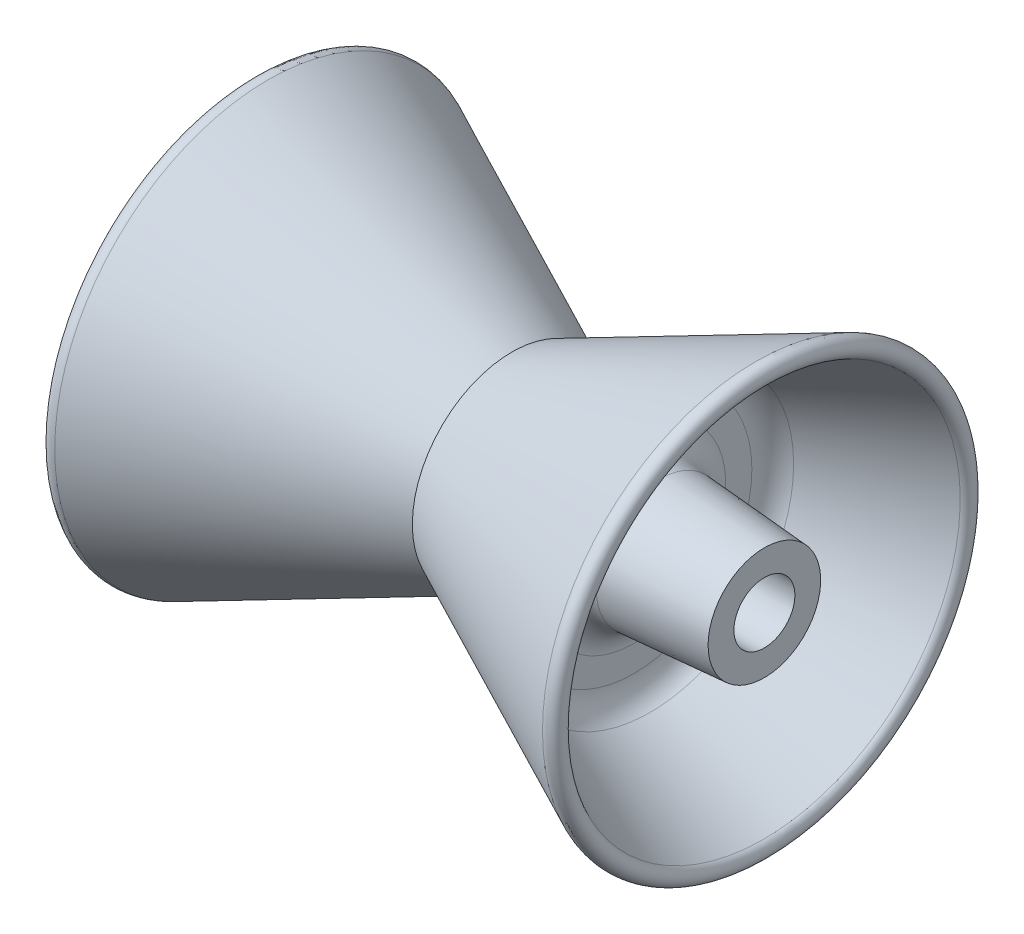
from build123d import *


with BuildPart() as part:
    # Sketch1 → Revolve2 (revolve)
    with BuildSketch(Plane.XY, mode=Mode.PRIVATE) as revolve2_sk:
        with BuildLine():
            Line((13665.962, 825.5), (13665.962, 1524))
            Line((13665.962, 1524), (10842.3080441, 1727.118653088))
            ThreePointArc((10842.3080441, 1727.118653088), (10339.170641367, 1968.028942231), (10134.981, 2487.154749529))
            Line((10134.981, 2487.154749529), (10134.981, 3192.342035814))
            ThreePointArc((10134.981, 3192.342035814), (10254.316718291, 3601.764337374), (10574.945884554, 3882.948569536))
            Line((10574.945884554, 3882.948569536), (13650.449899057, 5317.079644185))
            ThreePointArc((13650.449899057, 5317.079644185), (13773.307038482, 5654.626860575), (13435.759822093, 5777.484))
            Line((13435.759822093, 5777.484), (6832.981, 2698.557670153))
            Line((6832.981, 2698.557670153), (230.202177908, 5777.484))
            ThreePointArc((230.202177908, 5777.484), (-107.345038482, 5654.626860575), (15.512100943, 5317.079644185))
            Line((15.512100943, 5317.079644185), (3091.016115446, 3882.948569536))
            ThreePointArc((3091.016115446, 3882.948569536), (3411.645281709, 3601.764337374), (3530.981, 3192.342035814))
            Line((3530.981, 3192.342035814), (3530.981, 2487.154749529))
            ThreePointArc((3530.981, 2487.154749529), (3326.791358633, 1968.028942231), (2823.6539559, 1727.118653088))
            Line((2823.6539559, 1727.118653088), (0, 1524))
            Line((0, 1524), (0, 825.5))
            Line((0, 825.5), (3530.981, 825.5))
            Line((3530.981, 825.5), (4038.981, 825.5))
            Line((4038.981, 825.5), (4038.981, 2411.684209125))
            ThreePointArc((4038.981, 2411.684209125), (4357.847509102, 2992.901106677), (5019.367719115, 3036.259431963))
            Line((5019.367719115, 3036.259431963), (6832.981, 2190.557670154))
            Line((6832.981, 2190.557670154), (8646.594280885, 3036.259431963))
            ThreePointArc((8646.594280885, 3036.259431963), (9308.114490898, 2992.901106677), (9626.981, 2411.684209125))
            Line((9626.981, 2411.684209125), (9626.981, 825.5))
            Line((9626.981, 825.5), (10134.981, 825.5))
            Line((10134.981, 825.5), (13665.962, 825.5))
        make_face()
    revolve(revolve2_sk.sketch.rotate(Axis((0, 0, 0), (1, 0, 0)), 90), axis=Axis((0, 0, 0), (1, 0, 0)))


solid = part.part
